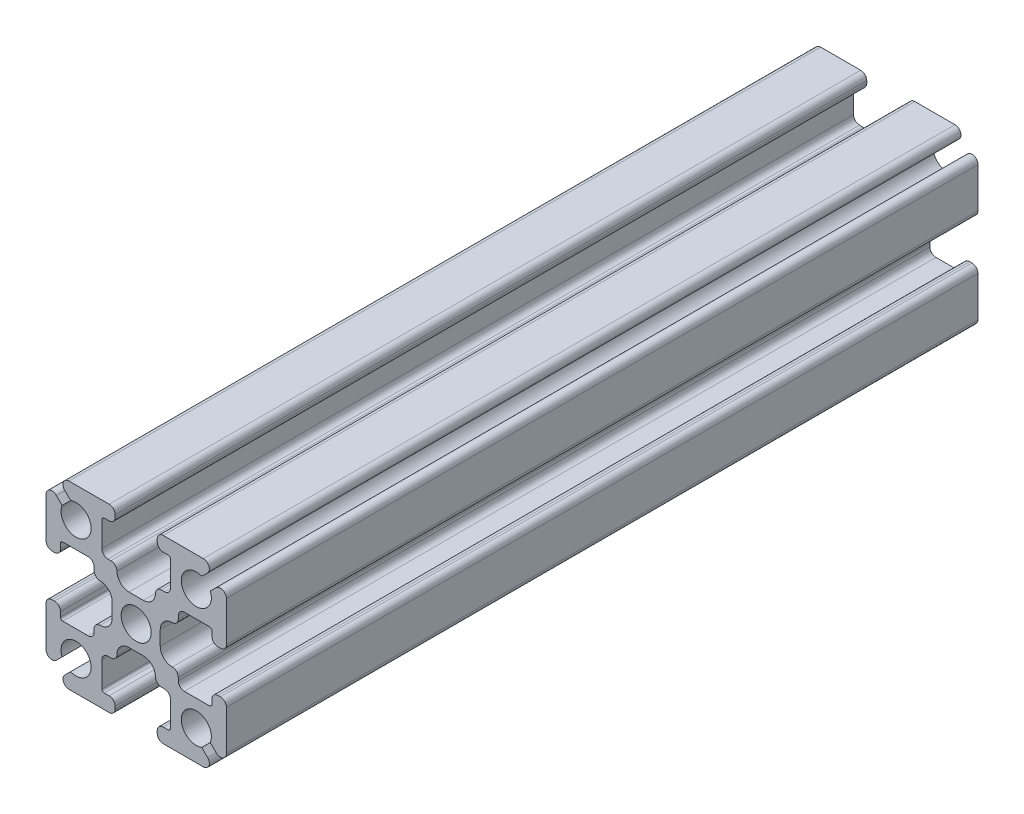
from build123d import *

# Parameters (mm, degrees)
SKETCH1_R           = 1.25
BOSS_EXTRUDE1_DEPTH = 62.5


with BuildPart() as part:
    # Sketch1 → Boss-Extrude1 (new body)
    with BuildSketch(Plane.XY):
        with BuildLine():
            Line((6.646446609, 5.939339828), (6.163645978, 5.456539197))
            ThreePointArc((6.163645978, 5.456539197), (4.116116524, 4.116116524), (5.456539197, 6.163645978))
            Line((5.456539197, 6.163645978), (5.939339828, 6.646446609))
            ThreePointArc((5.939339828, 6.646446609), (6.047726204, 7.191341716), (5.585786438, 7.5))
            Line((5.585786438, 7.5), (2.25, 7.5))
            ThreePointArc((2.25, 7.5), (1.896446609, 7.353553391), (1.75, 7))
            Line((1.75, 7), (1.75, 6.8))
            ThreePointArc((1.75, 6.8), (1.896446609, 6.446446609), (2.25, 6.3))
            Line((2.25, 6.3), (2.65, 6.3))
            ThreePointArc((2.65, 6.3), (2.791421356, 6.241421356), (2.85, 6.1))
            Line((2.85, 6.1), (2.85, 4))
            ThreePointArc((2.85, 4), (2.703553391, 3.646446609), (2.35, 3.5))
            Line((2.35, 3.5), (2.1, 3.5))
            ThreePointArc((2.1, 3.5), (1.746446609, 3.353553391), (1.6, 3))
            ThreePointArc((1.6, 3), (1.307106781, 2.292893219), (0.6, 2))
            Line((0.6, 2), (-0.6, 2))
            ThreePointArc((-0.6, 2), (-1.307106781, 2.292893219), (-1.6, 3))
            ThreePointArc((-1.6, 3), (-1.746446609, 3.353553391), (-2.1, 3.5))
            Line((-2.1, 3.5), (-2.35, 3.5))
            ThreePointArc((-2.35, 3.5), (-2.703553391, 3.646446609), (-2.85, 4))
            Line((-2.85, 4), (-2.85, 6.1))
            ThreePointArc((-2.85, 6.1), (-2.791421356, 6.241421356), (-2.65, 6.3))
            Line((-2.65, 6.3), (-2.25, 6.3))
            ThreePointArc((-2.25, 6.3), (-1.896446609, 6.446446609), (-1.75, 6.8))
            Line((-1.75, 6.8), (-1.75, 7))
            ThreePointArc((-1.75, 7), (-1.896446609, 7.353553391), (-2.25, 7.5))
            Line((-2.25, 7.5), (-5.585786438, 7.5))
            ThreePointArc((-5.585786438, 7.5), (-6.047726204, 7.191341716), (-5.939339828, 6.646446609))
            Line((-5.939339828, 6.646446609), (-5.456539197, 6.163645978))
            ThreePointArc((-5.456539197, 6.163645978), (-4.116116524, 4.116116524), (-6.163645978, 5.456539197))
            Line((-6.163645978, 5.456539197), (-6.646446609, 5.939339828))
            ThreePointArc((-6.646446609, 5.939339828), (-7.191341716, 6.047726204), (-7.5, 5.585786438))
            Line((-7.5, 5.585786438), (-7.5, 2.25))
            ThreePointArc((-7.5, 2.25), (-7.353553391, 1.896446609), (-7, 1.75))
            Line((-7, 1.75), (-6.8, 1.75))
            ThreePointArc((-6.8, 1.75), (-6.446446609, 1.896446609), (-6.3, 2.25))
            Line((-6.3, 2.25), (-6.3, 2.65))
            ThreePointArc((-6.3, 2.65), (-6.241421356, 2.791421356), (-6.1, 2.85))
            Line((-6.1, 2.85), (-4, 2.85))
            ThreePointArc((-4, 2.85), (-3.646446609, 2.703553391), (-3.5, 2.35))
            Line((-3.5, 2.35), (-3.5, 2.1))
            ThreePointArc((-3.5, 2.1), (-3.353553391, 1.746446609), (-3, 1.6))
            ThreePointArc((-3, 1.6), (-2.292893219, 1.307106781), (-2, 0.6))
            Line((-2, 0.6), (-2, -0.6))
            ThreePointArc((-2, -0.6), (-2.292893219, -1.307106781), (-3, -1.6))
            ThreePointArc((-3, -1.6), (-3.353553391, -1.746446609), (-3.5, -2.1))
            Line((-3.5, -2.1), (-3.5, -2.35))
            ThreePointArc((-3.5, -2.35), (-3.646446609, -2.703553391), (-4, -2.85))
            Line((-4, -2.85), (-6.1, -2.85))
            ThreePointArc((-6.1, -2.85), (-6.241421356, -2.791421356), (-6.3, -2.65))
            Line((-6.3, -2.65), (-6.3, -2.25))
            ThreePointArc((-6.3, -2.25), (-6.446446609, -1.896446609), (-6.8, -1.75))
            Line((-6.8, -1.75), (-7, -1.75))
            ThreePointArc((-7, -1.75), (-7.353553391, -1.896446609), (-7.5, -2.25))
            Line((-7.5, -2.25), (-7.5, -5.585786438))
            ThreePointArc((-7.5, -5.585786438), (-7.191341716, -6.047726204), (-6.646446609, -5.939339828))
            Line((-6.646446609, -5.939339828), (-6.163645978, -5.456539197))
            ThreePointArc((-6.163645978, -5.456539197), (-4.116116524, -4.116116524), (-5.456539197, -6.163645978))
            Line((-5.456539197, -6.163645978), (-5.939339828, -6.646446609))
            ThreePointArc((-5.939339828, -6.646446609), (-6.047726204, -7.191341716), (-5.585786438, -7.5))
            Line((-5.585786438, -7.5), (-2.25, -7.5))
            ThreePointArc((-2.25, -7.5), (-1.896446609, -7.353553391), (-1.75, -7))
            Line((-1.75, -7), (-1.75, -6.8))
            ThreePointArc((-1.75, -6.8), (-1.896446609, -6.446446609), (-2.25, -6.3))
            Line((-2.25, -6.3), (-2.65, -6.3))
            ThreePointArc((-2.65, -6.3), (-2.791421356, -6.241421356), (-2.85, -6.1))
            Line((-2.85, -6.1), (-2.85, -4))
            ThreePointArc((-2.85, -4), (-2.703553391, -3.646446609), (-2.35, -3.5))
            Line((-2.35, -3.5), (-2.1, -3.5))
            ThreePointArc((-2.1, -3.5), (-1.746446609, -3.353553391), (-1.6, -3))
            ThreePointArc((-1.6, -3), (-1.307106781, -2.292893219), (-0.6, -2))
            Line((-0.6, -2), (0.6, -2))
            ThreePointArc((0.6, -2), (1.307106781, -2.292893219), (1.6, -3))
            ThreePointArc((1.6, -3), (1.746446609, -3.353553391), (2.1, -3.5))
            Line((2.1, -3.5), (2.35, -3.5))
            ThreePointArc((2.35, -3.5), (2.703553391, -3.646446609), (2.85, -4))
            Line((2.85, -4), (2.85, -6.1))
            ThreePointArc((2.85, -6.1), (2.791421356, -6.241421356), (2.65, -6.3))
            Line((2.65, -6.3), (2.25, -6.3))
            ThreePointArc((2.25, -6.3), (1.896446609, -6.446446609), (1.75, -6.8))
            Line((1.75, -6.8), (1.75, -7))
            ThreePointArc((1.75, -7), (1.896446609, -7.353553391), (2.25, -7.5))
            Line((2.25, -7.5), (5.585786438, -7.5))
            ThreePointArc((5.585786438, -7.5), (6.047726204, -7.191341716), (5.939339828, -6.646446609))
            Line((5.939339828, -6.646446609), (5.456539197, -6.163645978))
            ThreePointArc((5.456539197, -6.163645978), (4.116116524, -4.116116524), (6.163645978, -5.456539197))
            Line((6.163645978, -5.456539197), (6.646446609, -5.939339828))
            ThreePointArc((6.646446609, -5.939339828), (7.191341716, -6.047726204), (7.5, -5.585786438))
            Line((7.5, -5.585786438), (7.5, -2.25))
            ThreePointArc((7.5, -2.25), (7.353553391, -1.896446609), (7, -1.75))
            Line((7, -1.75), (6.8, -1.75))
            ThreePointArc((6.8, -1.75), (6.446446609, -1.896446609), (6.3, -2.25))
            Line((6.3, -2.25), (6.3, -2.65))
            ThreePointArc((6.3, -2.65), (6.241421356, -2.791421356), (6.1, -2.85))
            Line((6.1, -2.85), (4, -2.85))
            ThreePointArc((4, -2.85), (3.646446609, -2.703553391), (3.5, -2.35))
            Line((3.5, -2.35), (3.5, -2.1))
            ThreePointArc((3.5, -2.1), (3.353553391, -1.746446609), (3, -1.6))
            ThreePointArc((3, -1.6), (2.292893219, -1.307106781), (2, -0.6))
            Line((2, -0.6), (2, 0.6))
            ThreePointArc((2, 0.6), (2.292893219, 1.307106781), (3, 1.6))
            ThreePointArc((3, 1.6), (3.353553391, 1.746446609), (3.5, 2.1))
            Line((3.5, 2.1), (3.5, 2.35))
            ThreePointArc((3.5, 2.35), (3.646446609, 2.703553391), (4, 2.85))
            Line((4, 2.85), (6.1, 2.85))
            ThreePointArc((6.1, 2.85), (6.241421356, 2.791421356), (6.3, 2.65))
            Line((6.3, 2.65), (6.3, 2.25))
            ThreePointArc((6.3, 2.25), (6.446446609, 1.896446609), (6.8, 1.75))
            Line((6.8, 1.75), (7, 1.75))
            ThreePointArc((7, 1.75), (7.353553391, 1.896446609), (7.5, 2.25))
            Line((7.5, 2.25), (7.5, 5.585786438))
            ThreePointArc((7.5, 5.585786438), (7.191341716, 6.047726204), (6.646446609, 5.939339828))
        make_face()
        with Locations(Location((0, 0, 0), (0, 0, 180))):
            Circle(SKETCH1_R, mode=Mode.SUBTRACT)
    extrude(amount=BOSS_EXTRUDE1_DEPTH)


solid = part.part
